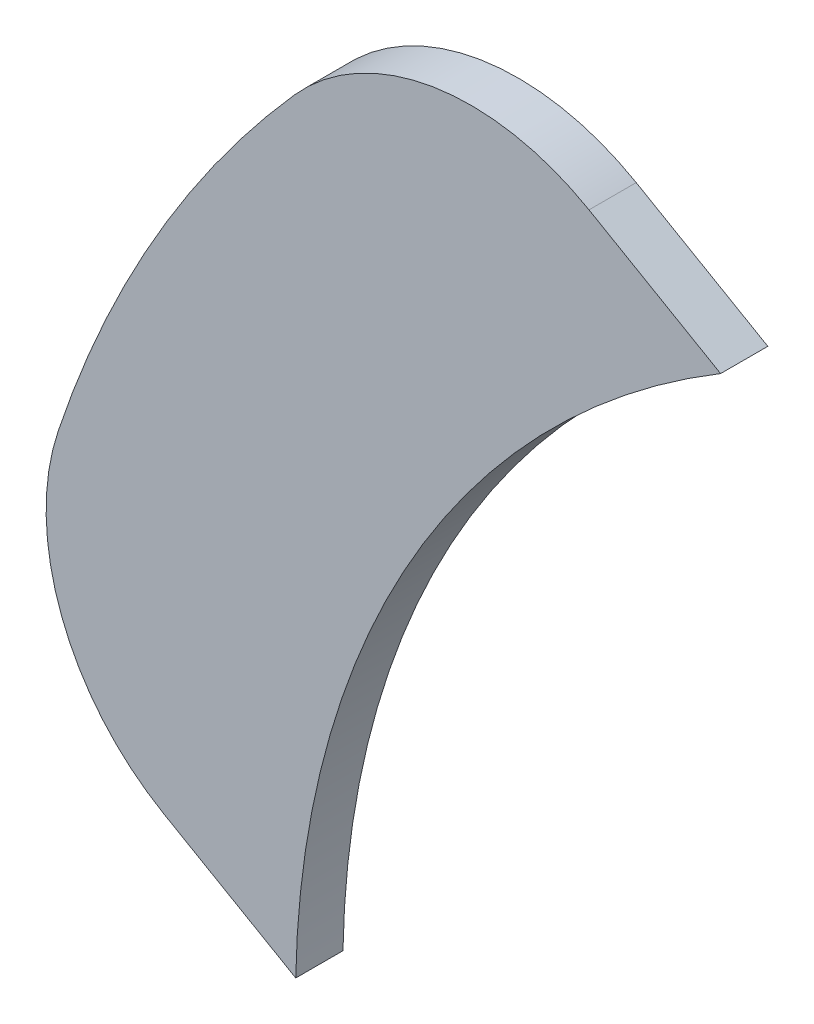
from build123d import *

# Parameters (mm, degrees)
BOSS_EXTRUDE1_DEPTH = 2


with BuildPart() as part:
    # Sketch1 → Boss-Extrude1 (new body)
    with BuildSketch(Plane.XY):
        with BuildLine():
            Line((-42.720125667, 3.879866363), (-37.14412683, 0.660561933))
            ThreePointArc((-37.14412683, 0.660561933), (-32.172843751, 18.575), (-19.14412683, 31.837476469))
            Line((-19.14412683, 31.837476469), (-24.720125667, 35.056780899))
            ThreePointArc((-24.720125667, 35.056780899), (-31.318030873, 36.268036318), (-37.196886841, 33.03716255))
            ThreePointArc((-37.196886841, 33.03716255), (-43.084763838, 24.875), (-47.209465457, 15.694867671))
            ThreePointArc((-47.209465457, 15.694867671), (-47.068056233, 8.988192174), (-42.720125667, 3.879866363))
        make_face()
    extrude(amount=BOSS_EXTRUDE1_DEPTH)


solid = part.part
